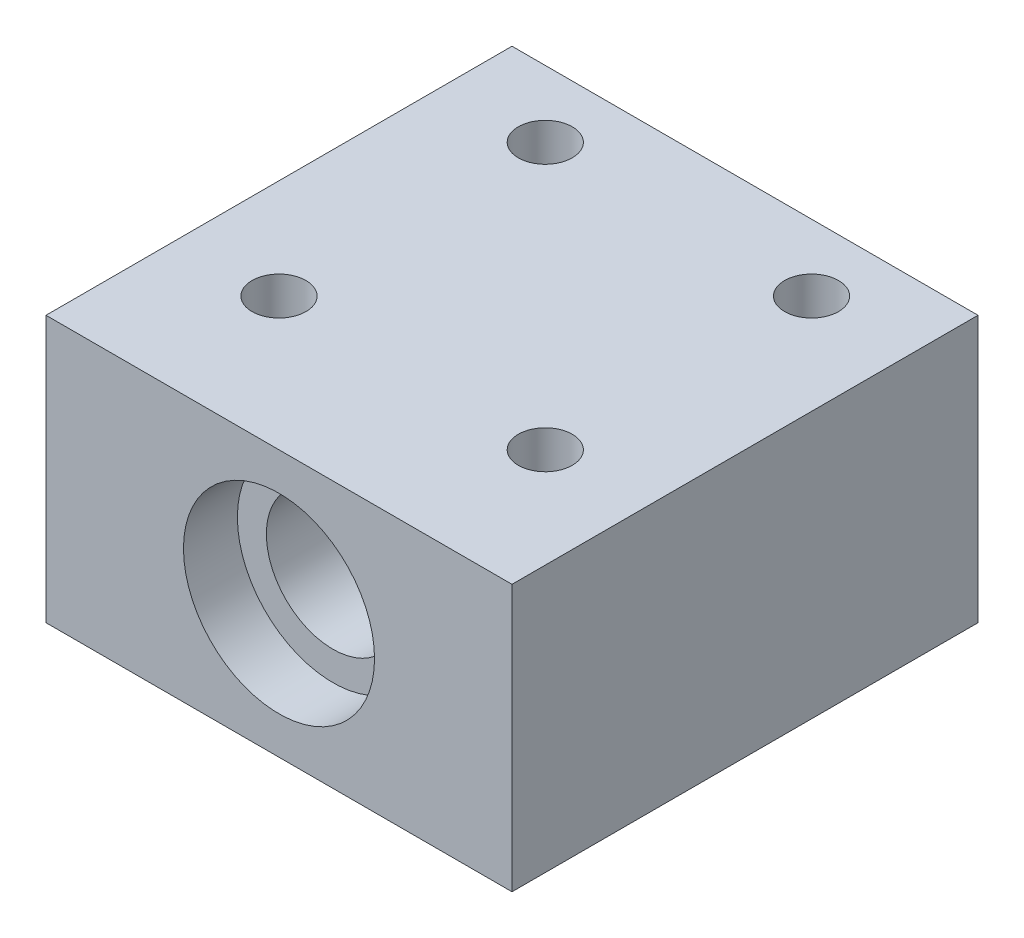
from build123d import *

# Parameters (mm, degrees)
BOSS_EXTRUDE1_DEPTH      = 40
BOSS_EXTRUDE1_DEPTH_BACK = 30
SKETCH1_W                = 70
SKETCH1_H                = 40
SKETCH1_R                = 10
CUT_EXTRUDE1_DEPTH       = 25
CUT_EXTRUDE1_DEPTH_BACK  = 25
SKETCH2_R                = 4.05
CUT_EXTRUDE2_START       = 40
SKETCH3_R                = 14.35
CUT_EXTRUDE2_DEPTH       = 8.1
CUT_EXTRUDE3_START       = -30
SKETCH4_R                = 14.2875
CUT_EXTRUDE3_DEPTH       = 8.1


with BuildPart() as part:
    # Sketch1 → Boss-Extrude1 (new, two sides: drawn at the far end of the back side and taken through both)
    with BuildSketch(Plane.XY.offset(-BOSS_EXTRUDE1_DEPTH_BACK)):
        Rectangle(SKETCH1_W, SKETCH1_H)
        Circle(SKETCH1_R, mode=Mode.SUBTRACT)
    extrude(amount=BOSS_EXTRUDE1_DEPTH + BOSS_EXTRUDE1_DEPTH_BACK)

    # Sketch2 → Cut-Extrude1 (cut, two sides: drawn at the far end of the back side and taken through both)
    with BuildSketch(Plane(origin=(0, 0, 0), x_dir=(1, 0, 0), z_dir=(0, 1, 0)).offset(-CUT_EXTRUDE1_DEPTH_BACK)):
        with Locations((-20, 20)):
            Circle(SKETCH2_R)
        with Locations((20, 20)):
            Circle(SKETCH2_R)
        with Locations((-20, -20)):
            Circle(SKETCH2_R)
        with Locations((20, -20)):
            Circle(SKETCH2_R)
    extrude(amount=CUT_EXTRUDE1_DEPTH + CUT_EXTRUDE1_DEPTH_BACK, mode=Mode.SUBTRACT)

    # Sketch3 → Cut-Extrude2 (cut)
    with BuildSketch(Plane.XY.offset(CUT_EXTRUDE2_START)):
        Circle(SKETCH3_R)
    extrude(amount=-CUT_EXTRUDE2_DEPTH, mode=Mode.SUBTRACT)

    # Sketch4 → Cut-Extrude3 (cut)
    with BuildSketch(Plane.XY.offset(CUT_EXTRUDE3_START)):
        Circle(SKETCH4_R)
    extrude(amount=CUT_EXTRUDE3_DEPTH, mode=Mode.SUBTRACT)


solid = part.part
